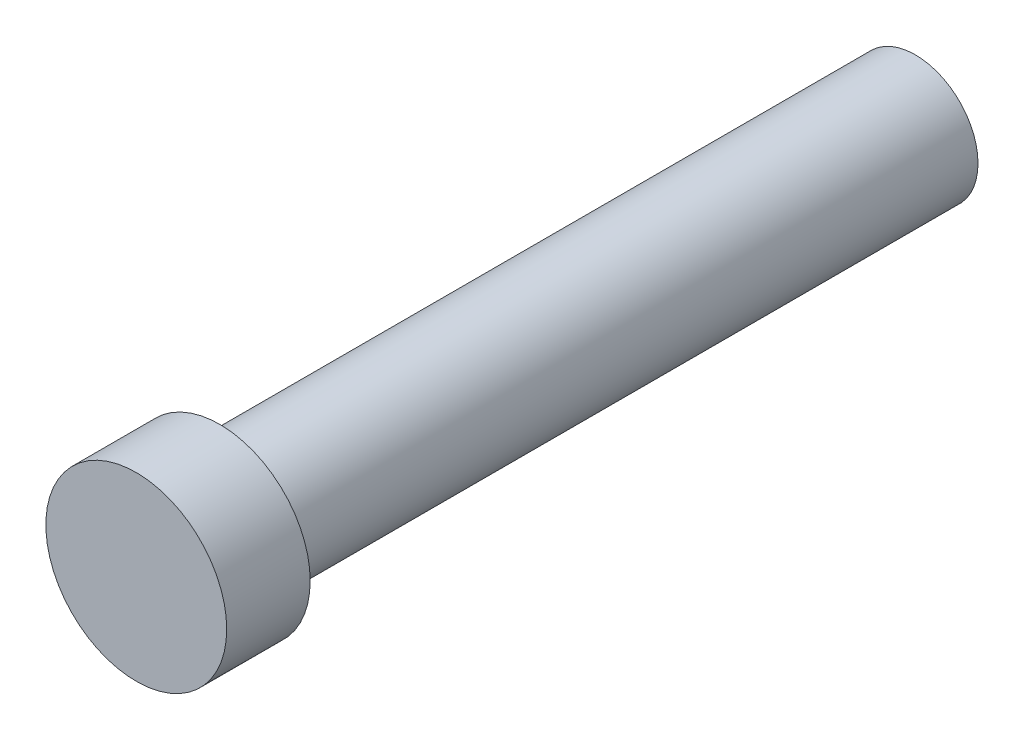
from build123d import *

# Parameters (mm, degrees)
ESQUISSE1_R                    = 2.25
ESQUISSE1_R_2                  = 1.25
EXTRU_MINCE1_DEPTH             = 25
BOSS_EXTRU_1_REACH             = 14.899
ESQUISSE2_R                    = 1.25
BOSS_EXTRU_1_DIRECTION_2_REACH = 14.899
ESQUISSE3_R                    = 3.25
BOSS_EXTRU_2_DEPTH             = 3


with BuildPart() as part:
    # Esquisse1 → Extru.-Mince1 (new body)
    with BuildSketch(Plane.XY):
        Circle(ESQUISSE1_R)
        Circle(ESQUISSE1_R_2, mode=Mode.SUBTRACT)
    extrude(amount=EXTRU_MINCE1_DEPTH)

    # Boss.-Extru.1: up to this face of the body (flat: up to its plane)
    boss_extru_1_end = Plane(part.part.faces().sort_by_distance((-2.18636039, 0, 0))[0])
    # Esquisse2 → Boss.-Extru.1 (add, up to the picked face)
    with BuildSketch(Plane(origin=(0, 0, 12.5), x_dir=(-1, 0, 0), z_dir=(0, 0, -1)), mode=Mode.PRIVATE) as boss_extru_1_sk1:
        Circle(ESQUISSE2_R)
    boss_extru_1_tool1 = split(extrude(boss_extru_1_sk1.sketch, amount=BOSS_EXTRU_1_REACH, mode=Mode.PRIVATE), bisect_by=boss_extru_1_end, keep=Keep.BOTH, mode=Mode.PRIVATE)
    add(boss_extru_1_tool1.solids().sort_by(Axis((0, 0, 12.5), (0, 0, -1)))[0])

    # Boss.-Extru.1 direction 2: up to this face of the body (flat: up to its plane)
    boss_extru_1_direction_2_end = Plane(part.part.faces().sort_by_distance((-2.18636039, 0, 25))[0])
    # Esquisse2 → Boss.-Extru.1 direction 2 (add, up to the picked face)
    with BuildSketch(Plane(origin=(0, 0, 12.5), x_dir=(-1, 0, 0), z_dir=(0, 0, -1)), mode=Mode.PRIVATE) as boss_extru_1_direction_2_sk1:
        Circle(ESQUISSE2_R)
    boss_extru_1_direction_2_tool1 = split(extrude(boss_extru_1_direction_2_sk1.sketch, amount=-BOSS_EXTRU_1_DIRECTION_2_REACH, mode=Mode.PRIVATE), bisect_by=boss_extru_1_direction_2_end, keep=Keep.BOTH, mode=Mode.PRIVATE)
    add(boss_extru_1_direction_2_tool1.solids().sort_by(Axis((0, 0, 12.5), (0, 0, 1)))[0])

    # Esquisse3 → Boss.-Extru.2 (add)
    with BuildSketch(Plane.XY.offset(25)):
        Circle(ESQUISSE3_R)
    extrude(amount=BOSS_EXTRU_2_DEPTH)


solid = part.part
